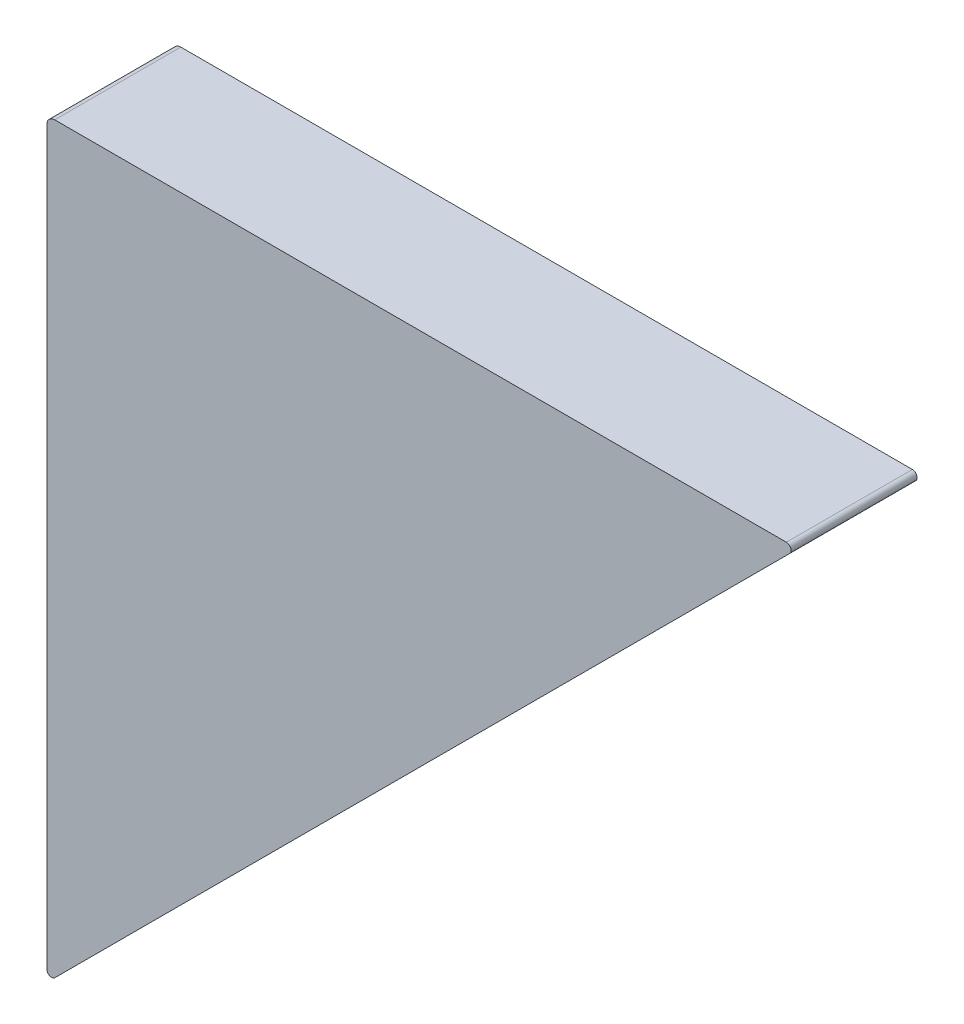
from build123d import *

# Parameters (mm, degrees)
BOSS_EXTRUDE1_DEPTH = 8


with BuildPart() as part:
    # Sketch1 → Boss-Extrude1 (new body)
    with BuildSketch(Plane.XY):
        with BuildLine():
            Line((0, 0.724264069), (0, 47.169047558))
            ThreePointArc((0, 47.169047558), (0.146446609, 47.522600949), (0.5, 47.669047558))
            Line((0.5, 47.669047558), (46.94478349, 47.669047558))
            ThreePointArc((46.94478349, 47.669047558), (47.221947349, 47.483852588), (47.156915524, 47.156915524))
            Line((47.156915524, 47.156915524), (0.512132034, 0.512132034))
            ThreePointArc((0.512132034, 0.512132034), (0.18519497, 0.447100209), (0, 0.724264069))
        make_face()
    extrude(amount=BOSS_EXTRUDE1_DEPTH)


solid = part.part
